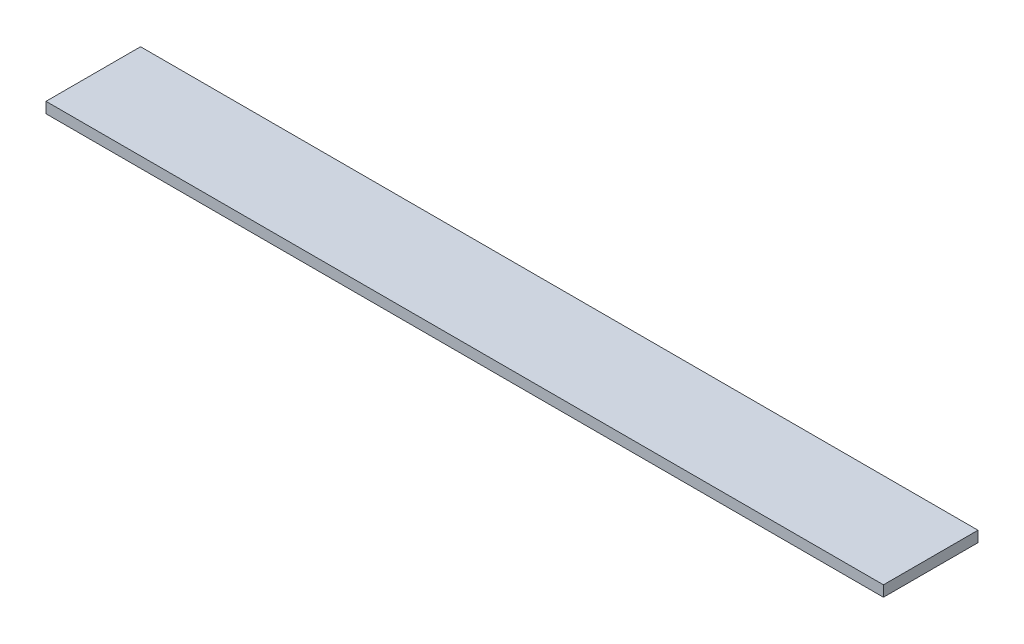
from build123d import *

# Parameters (mm, degrees)
CROQUIS1_W              = 310
CROQUIS1_H              = 35
SALIENTE_EXTRUIR1_DEPTH = 4


with BuildPart() as part:
    # Croquis1 → Saliente-Extruir1 (new body)
    with BuildSketch(Plane(origin=(0, 0, 0), x_dir=(1, 0, 0), z_dir=(0, 1, 0))):
        Rectangle(CROQUIS1_W, CROQUIS1_H)
    extrude(amount=SALIENTE_EXTRUIR1_DEPTH)


solid = part.part
